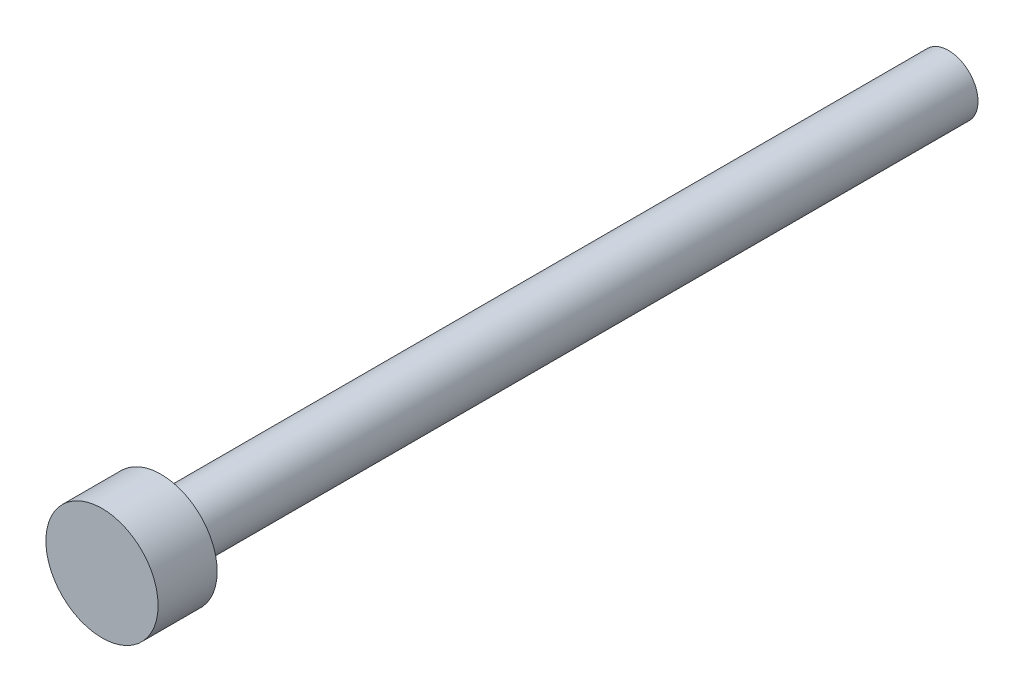
from build123d import *

# Parameters (mm, degrees)
SKETCH1_R           = 1.5
BOSS_EXTRUDE1_DEPTH = 40
SKETCH2_R           = 2.85
BOSS_EXTRUDE2_DEPTH = 3


with BuildPart() as part:
    # Sketch1 → Boss-Extrude1 (new body)
    with BuildSketch(Plane.XY):
        Circle(SKETCH1_R)
    extrude(amount=BOSS_EXTRUDE1_DEPTH)

    # Sketch2 → Boss-Extrude2 (add)
    with BuildSketch(Plane.XY.offset(40)):
        Circle(SKETCH2_R)
    extrude(amount=BOSS_EXTRUDE2_DEPTH)


solid = part.part
